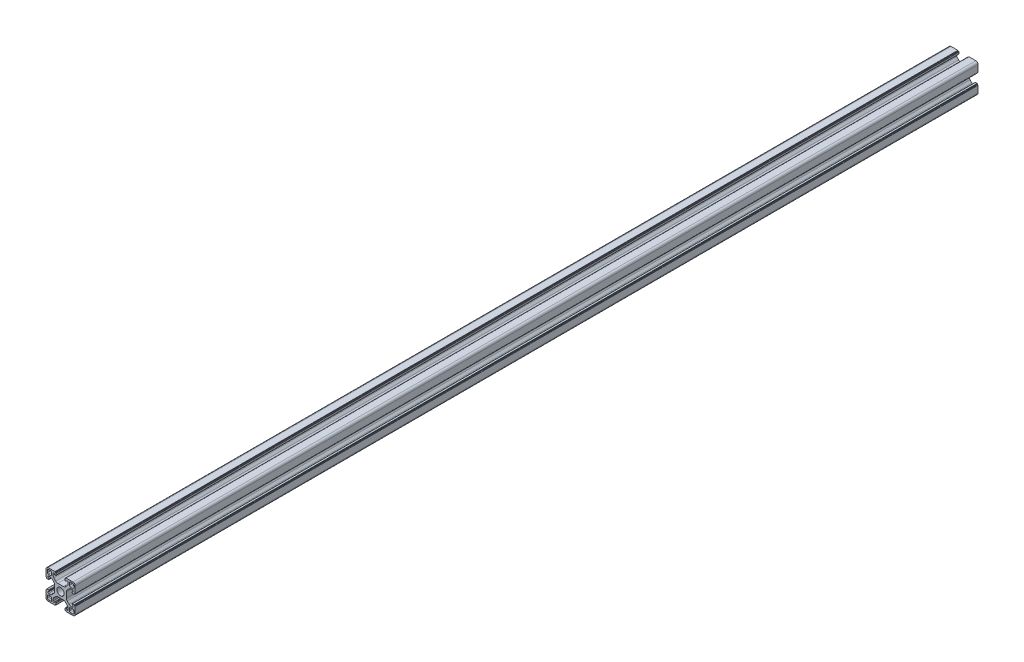
from build123d import *

# Parameters (mm, degrees)
EXTRUDE_1_DEPTH = 620


with BuildPart() as part:
    # Эскиз1 → Бобышка-Вытянуть1 (new body)
    with BuildSketch(Plane.XY):
        with BuildLine():
            Line((-31.105150957, 65.209647948), (-29.206370287, 65.209647948))
            ThreePointArc((-29.206370287, 65.209647948), (-28.441003423, 65.361888883), (-27.792156725, 65.795434385))
            Line((-27.792156725, 65.795434385), (-26.490937394, 67.096653716))
            ThreePointArc((-26.490937394, 67.096653716), (-26.057391892, 67.745500414), (-25.905150957, 68.510867279))
            Line((-25.905150957, 68.510867279), (-25.905150957, 69.409647948))
            ThreePointArc((-25.905150957, 69.409647948), (-26.051597566, 69.763201338), (-26.405150957, 69.909647948))
            Line((-26.405150957, 69.909647948), (-26.508044175, 69.909647948))
            ThreePointArc((-26.508044175, 69.909647948), (-26.699385892, 69.871587714), (-26.861597566, 69.763201338))
            Line((-26.861597566, 69.763201338), (-27.341927652, 69.282871252))
            ThreePointArc((-27.341927652, 69.282871252), (-27.423033489, 69.228678065), (-27.518704347, 69.209647948))
            Line((-27.518704347, 69.209647948), (-27.805150957, 69.209647948))
            ThreePointArc((-27.805150957, 69.209647948), (-27.981927652, 69.282871252), (-28.055150957, 69.459647948))
            Line((-28.055150957, 69.459647948), (-28.055150957, 70.608718768))
            ThreePointArc((-28.055150957, 70.608718768), (-28.011216974, 70.714784785), (-27.905150957, 70.758718768))
            Line((-27.905150957, 70.758718768), (-27.405150957, 70.758718768))
            Line((-27.405150957, 70.758718768), (-27.405150957, 71.059647948))
            ThreePointArc((-27.405150957, 71.059647948), (-27.361216974, 71.165713965), (-27.255150957, 71.209647948))
            Line((-27.255150957, 71.209647948), (-22.605150957, 71.209647948))
            ThreePointArc((-22.605150957, 71.209647948), (-21.544490785, 70.770308119), (-21.105150957, 69.709647948))
            Line((-21.105150957, 69.709647948), (-21.105150957, 65.059647948))
            ThreePointArc((-21.105150957, 65.059647948), (-21.149084939, 64.953581931), (-21.255150957, 64.909647948))
            Line((-21.255150957, 64.909647948), (-21.556080136, 64.909647948))
            Line((-21.556080136, 64.909647948), (-21.556080136, 64.409647948))
            ThreePointArc((-21.556080136, 64.409647948), (-21.600014119, 64.303581931), (-21.706080136, 64.259647948))
            Line((-21.706080136, 64.259647948), (-22.855150957, 64.259647948))
            ThreePointArc((-22.855150957, 64.259647948), (-23.031927652, 64.332871252), (-23.105150957, 64.509647948))
            Line((-23.105150957, 64.509647948), (-23.105150957, 64.796094557))
            ThreePointArc((-23.105150957, 64.796094557), (-23.08612084, 64.891765415), (-23.031927652, 64.972871252))
            Line((-23.031927652, 64.972871252), (-22.551597566, 65.453201338))
            ThreePointArc((-22.551597566, 65.453201338), (-22.44321119, 65.615413013), (-22.405150957, 65.806754729))
            Line((-22.405150957, 65.806754729), (-22.405150957, 65.909647948))
            ThreePointArc((-22.405150957, 65.909647948), (-22.551597566, 66.263201338), (-22.905150957, 66.409647948))
            Line((-22.905150957, 66.409647948), (-23.803931626, 66.409647948))
            ThreePointArc((-23.803931626, 66.409647948), (-24.56929849, 66.257407013), (-25.218145188, 65.82386151))
            Line((-25.218145188, 65.82386151), (-26.519364519, 64.522642179))
            ThreePointArc((-26.519364519, 64.522642179), (-26.952910022, 63.873795482), (-27.105150957, 63.108428617))
            Line((-27.105150957, 63.108428617), (-27.105150957, 61.209647948))
            Line((-27.105150957, 61.209647948), (-27.105150957, 59.310867279))
            ThreePointArc((-27.105150957, 59.310867279), (-26.952910022, 58.545500414), (-26.519364519, 57.896653716))
            Line((-26.519364519, 57.896653716), (-25.218145188, 56.595434385))
            ThreePointArc((-25.218145188, 56.595434385), (-24.56929849, 56.161888883), (-23.803931626, 56.009647948))
            Line((-23.803931626, 56.009647948), (-22.905150957, 56.009647948))
            ThreePointArc((-22.905150957, 56.009647948), (-22.551597566, 56.156094557), (-22.405150957, 56.509647948))
            Line((-22.405150957, 56.509647948), (-22.405150957, 56.612541166))
            ThreePointArc((-22.405150957, 56.612541166), (-22.44321119, 56.803882883), (-22.551597566, 56.966094557))
            Line((-22.551597566, 56.966094557), (-23.031927652, 57.446424643))
            ThreePointArc((-23.031927652, 57.446424643), (-23.08612084, 57.52753048), (-23.105150957, 57.623201338))
            Line((-23.105150957, 57.623201338), (-23.105150957, 57.909647948))
            ThreePointArc((-23.105150957, 57.909647948), (-23.031927652, 58.086424643), (-22.855150957, 58.159647948))
            Line((-22.855150957, 58.159647948), (-21.706080136, 58.159647948))
            ThreePointArc((-21.706080136, 58.159647948), (-21.600014119, 58.115713965), (-21.556080136, 58.009647948))
            Line((-21.556080136, 58.009647948), (-21.556080136, 57.509647948))
            Line((-21.556080136, 57.509647948), (-21.255150957, 57.509647948))
            ThreePointArc((-21.255150957, 57.509647948), (-21.149084939, 57.465713965), (-21.105150957, 57.359647948))
            Line((-21.105150957, 57.359647948), (-21.105150957, 52.709647948))
            ThreePointArc((-21.105150957, 52.709647948), (-21.544490785, 51.648987776), (-22.605150957, 51.209647948))
            Line((-22.605150957, 51.209647948), (-27.255150957, 51.209647948))
            ThreePointArc((-27.255150957, 51.209647948), (-27.361216974, 51.253581931), (-27.405150957, 51.359647948))
            Line((-27.405150957, 51.359647948), (-27.405150957, 51.660577127))
            Line((-27.405150957, 51.660577127), (-27.905150957, 51.660577127))
            ThreePointArc((-27.905150957, 51.660577127), (-28.011216974, 51.70451111), (-28.055150957, 51.810577127))
            Line((-28.055150957, 51.810577127), (-28.055150957, 52.959647948))
            ThreePointArc((-28.055150957, 52.959647948), (-27.981927652, 53.136424643), (-27.805150957, 53.209647948))
            Line((-27.805150957, 53.209647948), (-27.518704347, 53.209647948))
            ThreePointArc((-27.518704347, 53.209647948), (-27.423033489, 53.190617831), (-27.341927652, 53.136424643))
            Line((-27.341927652, 53.136424643), (-26.861597566, 52.656094557))
            ThreePointArc((-26.861597566, 52.656094557), (-26.699385892, 52.547708181), (-26.508044175, 52.509647948))
            Line((-26.508044175, 52.509647948), (-26.405150957, 52.509647948))
            ThreePointArc((-26.405150957, 52.509647948), (-26.051597566, 52.656094557), (-25.905150957, 53.009647948))
            Line((-25.905150957, 53.009647948), (-25.905150957, 53.908428617))
            ThreePointArc((-25.905150957, 53.908428617), (-26.057391892, 54.673795482), (-26.490937394, 55.322642179))
            Line((-26.490937394, 55.322642179), (-27.792156725, 56.62386151))
            ThreePointArc((-27.792156725, 56.62386151), (-28.441003423, 57.057407013), (-29.206370287, 57.209647948))
            Line((-29.206370287, 57.209647948), (-31.105150957, 57.209647948))
            Line((-31.105150957, 57.209647948), (-33.003931626, 57.209647948))
            ThreePointArc((-33.003931626, 57.209647948), (-33.76929849, 57.057407013), (-34.418145188, 56.62386151))
            Line((-34.418145188, 56.62386151), (-35.719364519, 55.322642179))
            ThreePointArc((-35.719364519, 55.322642179), (-36.152910022, 54.673795482), (-36.305150957, 53.908428617))
            Line((-36.305150957, 53.908428617), (-36.305150957, 53.009647948))
            ThreePointArc((-36.305150957, 53.009647948), (-36.158704347, 52.656094557), (-35.805150957, 52.509647948))
            Line((-35.805150957, 52.509647948), (-35.702257738, 52.509647948))
            ThreePointArc((-35.702257738, 52.509647948), (-35.510916022, 52.547708181), (-35.348704347, 52.656094557))
            Line((-35.348704347, 52.656094557), (-34.868374261, 53.136424643))
            ThreePointArc((-34.868374261, 53.136424643), (-34.787268424, 53.190617831), (-34.691597566, 53.209647948))
            Line((-34.691597566, 53.209647948), (-34.405150957, 53.209647948))
            ThreePointArc((-34.405150957, 53.209647948), (-34.228374261, 53.136424643), (-34.155150957, 52.959647948))
            Line((-34.155150957, 52.959647948), (-34.155150957, 51.810577127))
            ThreePointArc((-34.155150957, 51.810577127), (-34.199084939, 51.70451111), (-34.305150957, 51.660577127))
            Line((-34.305150957, 51.660577127), (-34.805150957, 51.660577127))
            Line((-34.805150957, 51.660577127), (-34.805150957, 51.359647948))
            ThreePointArc((-34.805150957, 51.359647948), (-34.849084939, 51.253581931), (-34.955150957, 51.209647948))
            Line((-34.955150957, 51.209647948), (-39.605150957, 51.209647948))
            ThreePointArc((-39.605150957, 51.209647948), (-40.665811128, 51.648987776), (-41.105150957, 52.709647948))
            Line((-41.105150957, 52.709647948), (-41.105150957, 57.359647948))
            ThreePointArc((-41.105150957, 57.359647948), (-41.061216974, 57.465713965), (-40.955150957, 57.509647948))
            Line((-40.955150957, 57.509647948), (-40.654221777, 57.509647948))
            Line((-40.654221777, 57.509647948), (-40.654221777, 58.009647948))
            ThreePointArc((-40.654221777, 58.009647948), (-40.610287794, 58.115713965), (-40.504221777, 58.159647948))
            Line((-40.504221777, 58.159647948), (-39.355150957, 58.159647948))
            ThreePointArc((-39.355150957, 58.159647948), (-39.178374261, 58.086424643), (-39.105150957, 57.909647948))
            Line((-39.105150957, 57.909647948), (-39.105150957, 57.623201338))
            ThreePointArc((-39.105150957, 57.623201338), (-39.124181073, 57.52753048), (-39.178374261, 57.446424643))
            Line((-39.178374261, 57.446424643), (-39.658704347, 56.966094557))
            ThreePointArc((-39.658704347, 56.966094557), (-39.767090723, 56.803882883), (-39.805150957, 56.612541166))
            Line((-39.805150957, 56.612541166), (-39.805150957, 56.509647948))
            ThreePointArc((-39.805150957, 56.509647948), (-39.658704347, 56.156094557), (-39.305150957, 56.009647948))
            Line((-39.305150957, 56.009647948), (-38.406370287, 56.009647948))
            ThreePointArc((-38.406370287, 56.009647948), (-37.641003423, 56.161888883), (-36.992156725, 56.595434385))
            Line((-36.992156725, 56.595434385), (-35.690937394, 57.896653716))
            ThreePointArc((-35.690937394, 57.896653716), (-35.257391892, 58.545500414), (-35.105150957, 59.310867279))
            Line((-35.105150957, 59.310867279), (-35.105150957, 61.209647948))
            Line((-35.105150957, 61.209647948), (-35.105150957, 63.108428617))
            ThreePointArc((-35.105150957, 63.108428617), (-35.257391892, 63.873795482), (-35.690937394, 64.522642179))
            Line((-35.690937394, 64.522642179), (-36.992156725, 65.82386151))
            ThreePointArc((-36.992156725, 65.82386151), (-37.641003423, 66.257407013), (-38.406370287, 66.409647948))
            Line((-38.406370287, 66.409647948), (-39.305150957, 66.409647948))
            ThreePointArc((-39.305150957, 66.409647948), (-39.658704347, 66.263201338), (-39.805150957, 65.909647948))
            Line((-39.805150957, 65.909647948), (-39.805150957, 65.806754729))
            ThreePointArc((-39.805150957, 65.806754729), (-39.767090723, 65.615413013), (-39.658704347, 65.453201338))
            Line((-39.658704347, 65.453201338), (-39.178374261, 64.972871252))
            ThreePointArc((-39.178374261, 64.972871252), (-39.124181073, 64.891765415), (-39.105150957, 64.796094557))
            Line((-39.105150957, 64.796094557), (-39.105150957, 64.509647948))
            ThreePointArc((-39.105150957, 64.509647948), (-39.178374261, 64.332871252), (-39.355150957, 64.259647948))
            Line((-39.355150957, 64.259647948), (-40.504221777, 64.259647948))
            ThreePointArc((-40.504221777, 64.259647948), (-40.610287794, 64.303581931), (-40.654221777, 64.409647948))
            Line((-40.654221777, 64.409647948), (-40.654221777, 64.909647948))
            Line((-40.654221777, 64.909647948), (-40.955150957, 64.909647948))
            ThreePointArc((-40.955150957, 64.909647948), (-41.061216974, 64.953581931), (-41.105150957, 65.059647948))
            Line((-41.105150957, 65.059647948), (-41.105150957, 69.709647948))
            ThreePointArc((-41.105150957, 69.709647948), (-40.665811128, 70.770308119), (-39.605150957, 71.209647948))
            Line((-39.605150957, 71.209647948), (-34.955150957, 71.209647948))
            ThreePointArc((-34.955150957, 71.209647948), (-34.849084939, 71.165713965), (-34.805150957, 71.059647948))
            Line((-34.805150957, 71.059647948), (-34.805150957, 70.758718768))
            Line((-34.805150957, 70.758718768), (-34.305150957, 70.758718768))
            ThreePointArc((-34.305150957, 70.758718768), (-34.199084939, 70.714784785), (-34.155150957, 70.608718768))
            Line((-34.155150957, 70.608718768), (-34.155150957, 69.459647948))
            ThreePointArc((-34.155150957, 69.459647948), (-34.228374261, 69.282871252), (-34.405150957, 69.209647948))
            Line((-34.405150957, 69.209647948), (-34.691597566, 69.209647948))
            ThreePointArc((-34.691597566, 69.209647948), (-34.787268424, 69.228678065), (-34.868374261, 69.282871252))
            Line((-34.868374261, 69.282871252), (-35.348704347, 69.763201338))
            ThreePointArc((-35.348704347, 69.763201338), (-35.510916022, 69.871587714), (-35.702257738, 69.909647948))
            Line((-35.702257738, 69.909647948), (-35.805150957, 69.909647948))
            ThreePointArc((-35.805150957, 69.909647948), (-36.158704347, 69.763201338), (-36.305150957, 69.409647948))
            Line((-36.305150957, 69.409647948), (-36.305150957, 68.510867279))
            ThreePointArc((-36.305150957, 68.510867279), (-36.152910022, 67.745500414), (-35.719364519, 67.096653716))
            Line((-35.719364519, 67.096653716), (-34.418145188, 65.795434385))
            ThreePointArc((-34.418145188, 65.795434385), (-33.76929849, 65.361888883), (-33.003931626, 65.209647948))
            Line((-33.003931626, 65.209647948), (-31.105150957, 65.209647948))
        make_face()
        with BuildLine():
            Line((-24.205150957, 67.309647948), (-22.805150957, 67.309647948))
            ThreePointArc((-22.805150957, 67.309647948), (-22.239465532, 67.543962523), (-22.005150957, 68.109647948))
            Line((-22.005150957, 68.109647948), (-22.005150957, 69.509647948))
            ThreePointArc((-22.005150957, 69.509647948), (-22.239465532, 70.075333373), (-22.805150957, 70.309647948))
            Line((-22.805150957, 70.309647948), (-24.205150957, 70.309647948))
            ThreePointArc((-24.205150957, 70.309647948), (-24.770836381, 70.075333373), (-25.005150957, 69.509647948))
            Line((-25.005150957, 69.509647948), (-25.005150957, 68.109647948))
            ThreePointArc((-25.005150957, 68.109647948), (-24.770836381, 67.543962523), (-24.205150957, 67.309647948))
        make_face(mode=Mode.SUBTRACT)
        with BuildLine():
            Line((-25.005150957, 54.309647948), (-25.005150957, 52.909647948))
            ThreePointArc((-25.005150957, 52.909647948), (-24.770836381, 52.343962523), (-24.205150957, 52.109647948))
            Line((-24.205150957, 52.109647948), (-22.805150957, 52.109647948))
            ThreePointArc((-22.805150957, 52.109647948), (-22.239465532, 52.343962523), (-22.005150957, 52.909647948))
            Line((-22.005150957, 52.909647948), (-22.005150957, 54.309647948))
            ThreePointArc((-22.005150957, 54.309647948), (-22.239465532, 54.875333373), (-22.805150957, 55.109647948))
            Line((-22.805150957, 55.109647948), (-24.205150957, 55.109647948))
            ThreePointArc((-24.205150957, 55.109647948), (-24.770836381, 54.875333373), (-25.005150957, 54.309647948))
        make_face(mode=Mode.SUBTRACT)
        with BuildLine():
            Line((-38.005150957, 55.109647948), (-39.405150957, 55.109647948))
            ThreePointArc((-39.405150957, 55.109647948), (-39.970836381, 54.875333373), (-40.205150957, 54.309647948))
            Line((-40.205150957, 54.309647948), (-40.205150957, 52.909647948))
            ThreePointArc((-40.205150957, 52.909647948), (-39.970836381, 52.343962523), (-39.405150957, 52.109647948))
            Line((-39.405150957, 52.109647948), (-38.005150957, 52.109647948))
            ThreePointArc((-38.005150957, 52.109647948), (-37.439465532, 52.343962523), (-37.205150957, 52.909647948))
            Line((-37.205150957, 52.909647948), (-37.205150957, 54.309647948))
            ThreePointArc((-37.205150957, 54.309647948), (-37.439465532, 54.875333373), (-38.005150957, 55.109647948))
        make_face(mode=Mode.SUBTRACT)
        with BuildLine():
            Line((-37.205150957, 68.109647948), (-37.205150957, 69.509647948))
            ThreePointArc((-37.205150957, 69.509647948), (-37.439465532, 70.075333373), (-38.005150957, 70.309647948))
            Line((-38.005150957, 70.309647948), (-39.405150957, 70.309647948))
            ThreePointArc((-39.405150957, 70.309647948), (-39.970836381, 70.075333373), (-40.205150957, 69.509647948))
            Line((-40.205150957, 69.509647948), (-40.205150957, 68.109647948))
            ThreePointArc((-40.205150957, 68.109647948), (-39.970836381, 67.543962523), (-39.405150957, 67.309647948))
            Line((-39.405150957, 67.309647948), (-38.005150957, 67.309647948))
            ThreePointArc((-38.005150957, 67.309647948), (-37.439465532, 67.543962523), (-37.205150957, 68.109647948))
        make_face(mode=Mode.SUBTRACT)
        with BuildLine():
            ThreePointArc((-28.605150957, 61.209647948), (-29.337384004, 62.977414901), (-31.105150957, 63.709647948))
            ThreePointArc((-31.105150957, 63.709647948), (-32.87291791, 62.977414901), (-33.605150957, 61.209647948))
            ThreePointArc((-33.605150957, 61.209647948), (-32.87291791, 59.441880995), (-31.105150957, 58.709647948))
            ThreePointArc((-31.105150957, 58.709647948), (-29.337384004, 59.441880995), (-28.605150957, 61.209647948))
        make_face(mode=Mode.SUBTRACT)
    extrude(amount=EXTRUDE_1_DEPTH)


solid = part.part
